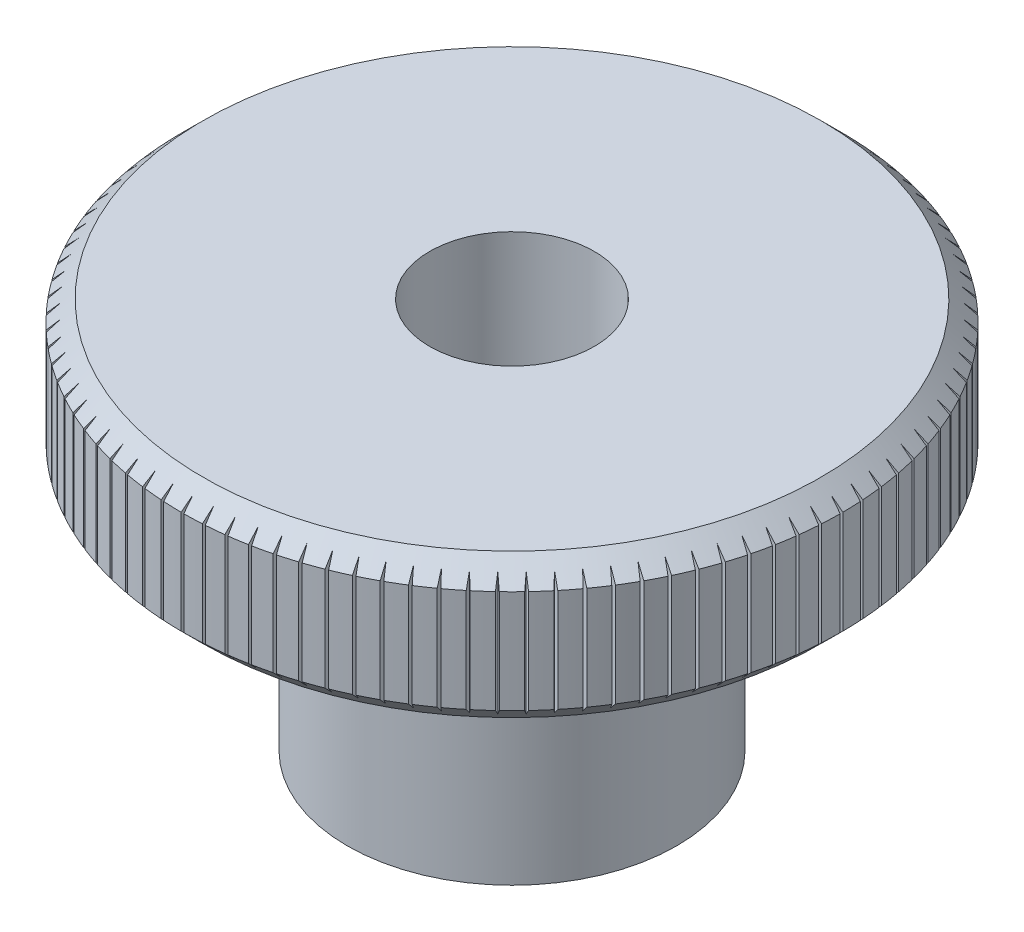
from build123d import *

# Parameters (mm, degrees)
FILLET1_R          = 0.8
CHAMFER1_SIZE      = 0.5
CUT_EXTRUDE1_DEPTH = 15.773286703
CIRPATTERN1_COUNT  = 100


with BuildPart() as part:
    # Sketch1 → Revolve1 (revolve)
    with BuildSketch(Plane.XY, mode=Mode.PRIVATE) as revolve1_sk:
        Polygon((2, 0), (2, 9.5), (8, 9.5), (8, 6), (4, 6), (4, 0), align=None)
    revolve(revolve1_sk.sketch.rotate(Axis((0, 0, 0), (0, -1, 0)), 90), axis=Axis((0, 0, 0), (0, -1, 0)))

    # Fillet1
    fillet1_edges = [part.edges().sort_by_distance(p)[0] for p in [
        (0, 6, -4),
    ]]
    fillet(fillet1_edges, radius=FILLET1_R)

    # Chamfer1
    chamfer1_edges = [part.edges().sort_by_distance(p)[0] for p in [
        (0, 6, -8),
        (0, 9.5, -8),
    ]]
    chamfer(chamfer1_edges, length=CHAMFER1_SIZE)

    # Sketch2 → Cut-Extrude1 (cut, through all)
    with BuildSketch(Plane(origin=(0, 9.5, 0), x_dir=(1, 0, 0), z_dir=(0, 1, 0))):
        Polygon((0.032913124, 8), (-0.032913124, 8), (0, 7.75), align=None)
    cut_extrude1 = extrude(amount=-CUT_EXTRUDE1_DEPTH, mode=Mode.SUBTRACT)

    # CirPattern1: Cut-Extrude1 ×100 about axis
    cirpattern1_axis = Axis((0, 0, 0), (0, 1, 0))
    for i in range(1, CIRPATTERN1_COUNT):
        add(cut_extrude1.rotate(cirpattern1_axis, i * 360 / CIRPATTERN1_COUNT), mode=Mode.SUBTRACT)


solid = part.part
